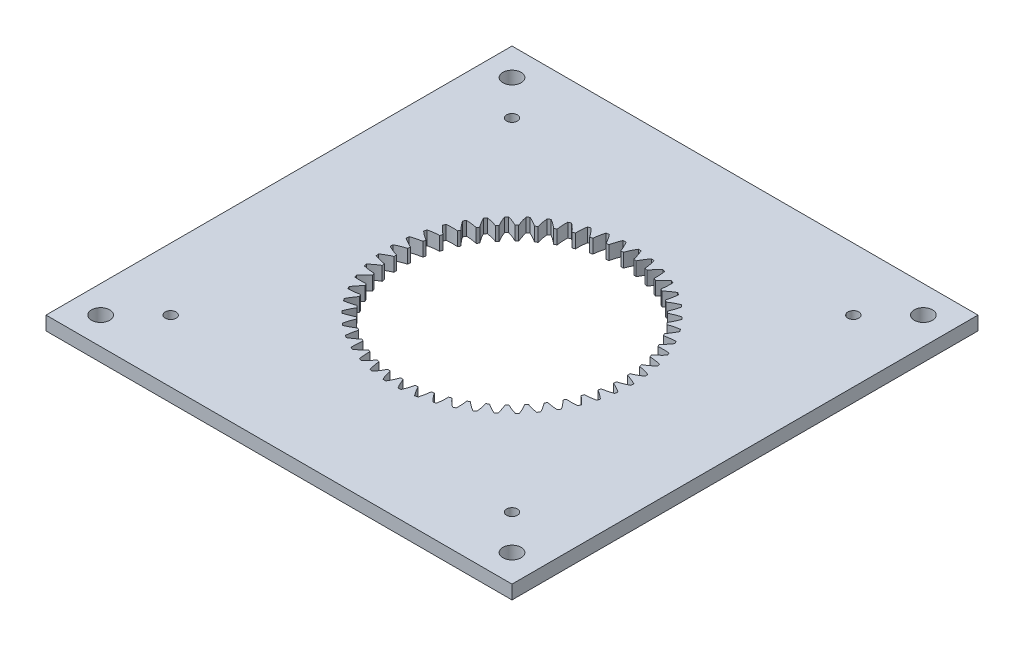
from build123d import *

# Parameters (mm, degrees)
SKETCH1_W           = 101.6
SKETCH1_H           = 101.6
BOSS_EXTRUDE1_DEPTH = 3
CUT_EXTRUDE2_DEPTH  = 161.150983893
SKETCH4_R           = 1.984375
SKETCH4_R_2         = 1.190625
CUT_EXTRUDE3_DEPTH  = 100


with BuildPart() as part:
    # Sketch1 → Boss-Extrude1 (new body)
    with BuildSketch(Plane(origin=(0, 0, 0), x_dir=(1, 0, 0), z_dir=(0, 1, 0))):
        Rectangle(SKETCH1_W, SKETCH1_H)
    extrude(amount=BOSS_EXTRUDE1_DEPTH)

    # Sketch3 → Cut-Extrude2 (cut, through all)
    with BuildSketch(Plane(origin=(-45.109803739, 10, -77.065738916), x_dir=(1, 0, 0), z_dir=(0, 1, 0))):
        with BuildLine():
            ThreePointArc((36.70104025, -52.197934478), (36.561215623, -53.418648212), (36.541912334, -54.6471922))
            ThreePointArc((36.541912334, -54.6471922), (36.274814475, -54.751103255), (36.008976503, -54.858196422))
            ThreePointArc((36.008976503, -54.858196422), (35.153908779, -53.975840408), (34.216344959, -53.181694937))
            ThreePointArc((34.216344959, -53.181694937), (33.932671556, -53.313123962), (33.65058352, -53.447922062))
            ThreePointArc((33.65058352, -53.447922062), (33.664857451, -54.676534776), (33.799683765, -55.897810672))
            ThreePointArc((33.799683765, -55.897810672), (33.547715561, -56.034378595), (33.297396134, -56.173945633))
            ThreePointArc((33.297396134, -56.173945633), (32.338482342, -55.405715663), (31.308778672, -54.735340171))
            ThreePointArc((31.308778672, -54.735340171), (31.043814544, -54.901286544), (30.780845538, -55.070376726))
            ThreePointArc((30.780845538, -55.070376726), (30.948992919, -56.287512464), (31.235822544, -57.482260017))
            ThreePointArc((31.235822544, -57.482260017), (31.002957684, -57.649331051), (30.772104489, -57.819170905))
            ThreePointArc((30.772104489, -57.819170905), (29.724467273, -57.177182423), (28.618862796, -56.641149133))
            ThreePointArc((28.618862796, -56.641149133), (28.376786584, -56.83899578), (28.137083787, -57.039711392))
            ThreePointArc((28.137083787, -57.039711392), (28.456452833, -58.226175196), (28.890762295, -59.375552523))
            ThreePointArc((28.890762295, -59.375552523), (28.680673197, -59.570491858), (28.472926926, -59.767926051))
            ThreePointArc((28.472926926, -59.767926051), (27.35308815, -59.262303601), (26.189018909, -58.869066077))
            ThreePointArc((26.189018909, -58.869066077), (25.973648301, -59.095692838), (25.760991968, -59.324868474))
            ThreePointArc((25.760991968, -59.324868474), (26.226546039, -60.461949102), (26.801486018, -61.547829836))
            ThreePointArc((26.801486018, -61.547829836), (26.617485912, -61.767563162), (26.436122849, -61.98947804))
            ThreePointArc((26.436122849, -61.98947804), (25.261743039, -61.628195588), (24.057567102, -61.383955422))
            ThreePointArc((24.057567102, -61.383955422), (23.87229862, -61.635788258), (23.690042469, -61.889809681))
            ThreePointArc((23.690042469, -61.889809681), (24.2944395, -62.959574692), (25.000942849, -63.964833845))
            ThreePointArc((25.000942849, -63.964833845), (24.845933527, -64.205895837), (24.693813875, -64.448791668))
            ThreePointArc((24.693813875, -64.448791668), (23.483413703, -64.237546856), (22.258121642, -64.14615586))
            ThreePointArc((22.258121642, -64.14615586), (22.105877081, -64.419223217), (21.956895401, -64.694084358))
            ThreePointArc((21.956895401, -64.694084358), (22.690603688, -65.679662918), (23.517528428, -66.588446953))
            ThreePointArc((23.517528428, -66.588446953), (23.39395448, -66.847035919), (23.273477256, -67.107082092))
            ThreePointArc((23.273477256, -67.107082092), (22.046145456, -67.049206375), (20.81906086, -67.112105841))
            ThreePointArc((20.81906086, -67.112105841), (20.702241208, -67.402101284), (20.588883529, -67.693467418))
            ThreePointArc((20.588883529, -67.693467418), (21.440332055, -68.579316364), (22.374637087, -69.377293214))
            ThreePointArc((22.374637087, -69.377293214), (22.284447348, -69.649331051), (22.197512551, -69.922426483))
            ThreePointArc((22.197512551, -69.922426483), (20.972604878, -70.018832596), (19.763079604, -70.235030562))
            ThreePointArc((19.763079604, -70.235030562), (19.683527176, -70.537380688), (19.607581216, -70.840656798))
            ThreePointArc((19.607581216, -70.840656798), (20.563342129, -71.612805764), (21.590292906, -72.287390857))
            ThreePointArc((21.590292906, -72.287390857), (21.534909722, -72.568587366), (21.482888365, -72.850425178))
            ThreePointArc((21.482888365, -72.850425178), (20.279722344, -73.09959274), (19.106831329, -73.465679633))
            ThreePointArc((19.106831329, -73.465679633), (19.065800715, -73.775616202), (19.028464187, -74.086019442))
            ThreePointArc((19.028464187, -74.086019442), (20.073464566, -74.732291177), (21.176865461, -75.272845904))
            ThreePointArc((21.176865461, -75.272845904), (21.157162257, -75.558766447), (21.140874749, -75.844901889))
            ThreePointArc((21.140874749, -75.844901889), (19.978425028, -76.242901378), (18.860665462, -76.75310379))
            ThreePointArc((18.860665462, -76.75310379), (18.858803739, -77.065738916), (18.860665462, -77.378374042))
            ThreePointArc((18.860665462, -77.378374042), (19.978425028, -77.888576454), (21.140874749, -78.286575944))
            ThreePointArc((21.140874749, -78.286575944), (21.157162257, -78.572711385), (21.176865461, -78.858631929))
            ThreePointArc((21.176865461, -78.858631929), (20.073464566, -79.399186656), (19.028464187, -80.04545839))
            ThreePointArc((19.028464187, -80.04545839), (19.065800715, -80.35586163), (19.106831329, -80.665798199))
            ThreePointArc((19.106831329, -80.665798199), (20.279722344, -81.031885092), (21.482888365, -81.281052655))
            ThreePointArc((21.482888365, -81.281052655), (21.534909722, -81.562890466), (21.590292906, -81.844086975))
            ThreePointArc((21.590292906, -81.844086975), (20.563342129, -82.518672069), (19.607581216, -83.290821034))
            ThreePointArc((19.607581216, -83.290821034), (19.683527176, -83.594097144), (19.763079604, -83.896447271))
            ThreePointArc((19.763079604, -83.896447271), (20.972604878, -84.112645236), (22.197512551, -84.20905135))
            ThreePointArc((22.197512551, -84.20905135), (22.284447348, -84.482146781), (22.374637087, -84.754184618))
            ThreePointArc((22.374637087, -84.754184618), (21.440332055, -85.552161468), (20.588883529, -86.438010414))
            ThreePointArc((20.588883529, -86.438010414), (20.702241208, -86.729376549), (20.81906086, -87.019371991))
            ThreePointArc((20.81906086, -87.019371991), (22.046145456, -87.082271457), (23.273477256, -87.02439574))
            ThreePointArc((23.273477256, -87.02439574), (23.39395448, -87.284441914), (23.517528428, -87.543030879))
            ThreePointArc((23.517528428, -87.543030879), (22.690603688, -88.451814915), (21.956895401, -89.437393474))
            ThreePointArc((21.956895401, -89.437393474), (22.105877081, -89.712254615), (22.258121642, -89.985321972))
            ThreePointArc((22.258121642, -89.985321972), (23.483413703, -89.893930977), (24.693813875, -89.682686164))
            ThreePointArc((24.693813875, -89.682686164), (24.845933527, -89.925581996), (25.000942849, -90.166643987))
            ThreePointArc((25.000942849, -90.166643987), (24.2944395, -91.171903141), (23.690042469, -92.241668151))
            ThreePointArc((23.690042469, -92.241668151), (23.87229862, -92.495689574), (24.057567102, -92.74752241))
            ThreePointArc((24.057567102, -92.74752241), (25.261743039, -92.503282244), (26.436122849, -92.141999793))
            ThreePointArc((26.436122849, -92.141999793), (26.617485912, -92.36391467), (26.801486018, -92.583647997))
            ThreePointArc((26.801486018, -92.583647997), (26.226546039, -93.66952873), (25.760991968, -94.806609358))
            ThreePointArc((25.760991968, -94.806609358), (25.973648301, -95.035784994), (26.189018909, -95.262411755))
            ThreePointArc((26.189018909, -95.262411755), (27.35308815, -94.869174232), (28.472926926, -94.363551781))
            ThreePointArc((28.472926926, -94.363551781), (28.680673197, -94.560985974), (28.890762295, -94.75592531))
            ThreePointArc((28.890762295, -94.75592531), (28.456452833, -95.905302636), (28.137083787, -97.091766441))
            ThreePointArc((28.137083787, -97.091766441), (28.376786584, -97.292482052), (28.618862796, -97.490328699))
            ThreePointArc((28.618862796, -97.490328699), (29.724467273, -96.954295409), (30.772104489, -96.312306927))
            ThreePointArc((30.772104489, -96.312306927), (31.002957684, -96.482146781), (31.235822544, -96.649217816))
            ThreePointArc((31.235822544, -96.649217816), (30.948992919, -97.843965368), (30.780845538, -99.061101106))
            ThreePointArc((30.780845538, -99.061101106), (31.043814544, -99.230191289), (31.308778672, -99.396137661))
            ThreePointArc((31.308778672, -99.396137661), (32.338482342, -98.725762169), (33.297396134, -97.957532199))
            ThreePointArc((33.297396134, -97.957532199), (33.547715561, -98.097099237), (33.799683765, -98.233667161))
            ThreePointArc((33.799683765, -98.233667161), (33.664857451, -99.454943056), (33.65058352, -100.683555771))
            ThreePointArc((33.65058352, -100.683555771), (33.932671556, -100.81835387), (34.216344959, -100.949782895))
            ThreePointArc((34.216344959, -100.949782895), (35.153908779, -100.155637424), (36.008976503, -99.27328141))
            ThreePointArc((36.008976503, -99.27328141), (36.274814475, -99.380374577), (36.541912334, -99.484285632))
            ThreePointArc((36.541912334, -99.484285632), (36.561215623, -100.71282962), (36.70104025, -101.933543355))
            ThreePointArc((36.70104025, -101.933543355), (36.99779862, -102.031923525), (37.295707597, -102.126762488))
            ThreePointArc((37.295707597, -102.126762488), (38.126345628, -101.221371186), (38.864082354, -100.23880441))
            ThreePointArc((38.864082354, -100.23880441), (39.141246447, -100.311734783), (39.419261668, -100.38135023))
            ThreePointArc((39.419261668, -100.38135023), (39.592390136, -101.597787438), (39.884108204, -102.791350807))
            ThreePointArc((39.884108204, -102.791350807), (40.19085685, -102.851761535), (40.4983032, -102.908514769))
            ThreePointArc((40.4983032, -102.908514769), (41.208915782, -101.906156197), (41.817686963, -100.838874324))
            ThreePointArc((41.817686963, -100.838874324), (42.101806134, -100.876491748), (42.386354251, -100.910713709))
            ThreePointArc((42.386354251, -100.910713709), (42.710577557, -102.095860196), (43.149588498, -103.243449993))
            ThreePointArc((43.149588498, -103.243449993), (43.461489811, -103.264938564), (43.773624921, -103.282711037))
            ThreePointArc((43.773624921, -103.282711037), (44.353005269, -102.199192989), (44.82321022, -101.064027692))
            ThreePointArc((44.82321022, -101.064027692), (45.109803739, -101.065738916), (45.396397258, -101.064027692))
            ThreePointArc((45.396397258, -101.064027692), (45.866602209, -102.199192989), (46.445982557, -103.282711037))
            ThreePointArc((46.445982557, -103.282711037), (46.758117667, -103.264938564), (47.07001898, -103.243449993))
            ThreePointArc((47.07001898, -103.243449993), (47.509029921, -102.095860196), (47.833253227, -100.910713709))
            ThreePointArc((47.833253227, -100.910713709), (48.117801345, -100.876491748), (48.401920515, -100.838874324))
            ThreePointArc((48.401920515, -100.838874324), (49.010691696, -101.906156197), (49.721304278, -102.908514769))
            ThreePointArc((49.721304278, -102.908514769), (50.028750628, -102.851761535), (50.335499274, -102.791350807))
            ThreePointArc((50.335499274, -102.791350807), (50.627217342, -101.597787438), (50.80034581, -100.38135023))
            ThreePointArc((50.80034581, -100.38135023), (51.078361031, -100.311734783), (51.355525124, -100.23880441))
            ThreePointArc((51.355525124, -100.23880441), (52.093261851, -101.221371186), (52.923899881, -102.126762488))
            ThreePointArc((52.923899881, -102.126762488), (53.221808858, -102.031923525), (53.518567228, -101.933543355))
            ThreePointArc((53.518567228, -101.933543355), (53.658391855, -100.71282962), (53.677695144, -99.484285632))
            ThreePointArc((53.677695144, -99.484285632), (53.944793004, -99.380374577), (54.210630975, -99.27328141))
            ThreePointArc((54.210630975, -99.27328141), (55.065698699, -100.155637424), (56.00326252, -100.949782895))
            ThreePointArc((56.00326252, -100.949782895), (56.286935922, -100.81835387), (56.569023958, -100.683555771))
            ThreePointArc((56.569023958, -100.683555771), (56.554750027, -99.454943056), (56.419923713, -98.233667161))
            ThreePointArc((56.419923713, -98.233667161), (56.671891918, -98.097099237), (56.922211344, -97.957532199))
            ThreePointArc((56.922211344, -97.957532199), (57.881125136, -98.725762169), (58.910828806, -99.396137661))
            ThreePointArc((58.910828806, -99.396137661), (59.175792934, -99.230191289), (59.43876194, -99.061101106))
            ThreePointArc((59.43876194, -99.061101106), (59.270614559, -97.843965368), (58.983784934, -96.649217816))
            ThreePointArc((58.983784934, -96.649217816), (59.216649794, -96.482146781), (59.447502989, -96.312306927))
            ThreePointArc((59.447502989, -96.312306927), (60.495140206, -96.954295409), (61.600744682, -97.490328699))
            ThreePointArc((61.600744682, -97.490328699), (61.842820894, -97.292482052), (62.082523692, -97.091766441))
            ThreePointArc((62.082523692, -97.091766441), (61.763154645, -95.905302636), (61.328845183, -94.75592531))
            ThreePointArc((61.328845183, -94.75592531), (61.538934281, -94.560985974), (61.746680552, -94.363551781))
            ThreePointArc((61.746680552, -94.363551781), (62.866519328, -94.869174232), (64.030588569, -95.262411755))
            ThreePointArc((64.030588569, -95.262411755), (64.245959178, -95.035784994), (64.45861551, -94.806609358))
            ThreePointArc((64.45861551, -94.806609358), (63.993061439, -93.66952873), (63.41812146, -92.583647997))
            ThreePointArc((63.41812146, -92.583647997), (63.602121566, -92.36391467), (63.783484629, -92.141999793))
            ThreePointArc((63.783484629, -92.141999793), (64.957864439, -92.503282244), (66.162040377, -92.74752241))
            ThreePointArc((66.162040377, -92.74752241), (66.347308858, -92.495689574), (66.529565009, -92.241668151))
            ThreePointArc((66.529565009, -92.241668151), (65.925167979, -91.171903141), (65.21866463, -90.166643987))
            ThreePointArc((65.21866463, -90.166643987), (65.373673951, -89.925581996), (65.525793603, -89.682686164))
            ThreePointArc((65.525793603, -89.682686164), (66.736193776, -89.893930977), (67.961485836, -89.985321972))
            ThreePointArc((67.961485836, -89.985321972), (68.113730397, -89.712254615), (68.262712077, -89.437393474))
            ThreePointArc((68.262712077, -89.437393474), (67.52900379, -88.451814915), (66.70207905, -87.543030879))
            ThreePointArc((66.70207905, -87.543030879), (66.825652998, -87.284441914), (66.946130222, -87.02439574))
            ThreePointArc((66.946130222, -87.02439574), (68.173462022, -87.082271457), (69.400546618, -87.019371991))
            ThreePointArc((69.400546618, -87.019371991), (69.51736627, -86.729376549), (69.63072395, -86.438010414))
            ThreePointArc((69.63072395, -86.438010414), (68.779275424, -85.552161468), (67.844970391, -84.754184618))
            ThreePointArc((67.844970391, -84.754184618), (67.93516013, -84.482146781), (68.022094927, -84.20905135))
            ThreePointArc((68.022094927, -84.20905135), (69.247002601, -84.112645236), (70.456527874, -83.896447271))
            ThreePointArc((70.456527874, -83.896447271), (70.536080302, -83.594097144), (70.612026262, -83.290821034))
            ThreePointArc((70.612026262, -83.290821034), (69.656265349, -82.518672069), (68.629314572, -81.844086975))
            ThreePointArc((68.629314572, -81.844086975), (68.684697757, -81.562890466), (68.736719113, -81.281052655))
            ThreePointArc((68.736719113, -81.281052655), (69.939885134, -81.031885092), (71.112776149, -80.665798199))
            ThreePointArc((71.112776149, -80.665798199), (71.153806763, -80.35586163), (71.191143292, -80.04545839))
            ThreePointArc((71.191143292, -80.04545839), (70.146142912, -79.399186656), (69.042742018, -78.858631929))
            ThreePointArc((69.042742018, -78.858631929), (69.062445221, -78.572711385), (69.07873273, -78.286575944))
            ThreePointArc((69.07873273, -78.286575944), (70.241182451, -77.888576454), (71.358942016, -77.378374042))
            ThreePointArc((71.358942016, -77.378374042), (71.360803739, -77.065738916), (71.358942016, -76.75310379))
            ThreePointArc((71.358942016, -76.75310379), (70.241182451, -76.242901378), (69.07873273, -75.844901889))
            ThreePointArc((69.07873273, -75.844901889), (69.062445221, -75.558766447), (69.042742018, -75.272845904))
            ThreePointArc((69.042742018, -75.272845904), (70.146142912, -74.732291177), (71.191143292, -74.086019442))
            ThreePointArc((71.191143292, -74.086019442), (71.153806763, -73.775616202), (71.112776149, -73.465679633))
            ThreePointArc((71.112776149, -73.465679633), (69.939885134, -73.09959274), (68.736719113, -72.850425178))
            ThreePointArc((68.736719113, -72.850425178), (68.684697757, -72.568587366), (68.629314572, -72.287390857))
            ThreePointArc((68.629314572, -72.287390857), (69.656265349, -71.612805764), (70.612026262, -70.840656798))
            ThreePointArc((70.612026262, -70.840656798), (70.536080302, -70.537380688), (70.456527874, -70.235030562))
            ThreePointArc((70.456527874, -70.235030562), (69.247002601, -70.018832596), (68.022094927, -69.922426483))
            ThreePointArc((68.022094927, -69.922426483), (67.93516013, -69.649331051), (67.844970391, -69.377293214))
            ThreePointArc((67.844970391, -69.377293214), (68.779275424, -68.579316364), (69.63072395, -67.693467418))
            ThreePointArc((69.63072395, -67.693467418), (69.51736627, -67.402101284), (69.400546618, -67.112105841))
            ThreePointArc((69.400546618, -67.112105841), (68.173462022, -67.049206375), (66.946130222, -67.107082092))
            ThreePointArc((66.946130222, -67.107082092), (66.825652998, -66.847035919), (66.70207905, -66.588446953))
            ThreePointArc((66.70207905, -66.588446953), (67.52900379, -65.679662918), (68.262712077, -64.694084358))
            ThreePointArc((68.262712077, -64.694084358), (68.113730397, -64.419223217), (67.961485836, -64.14615586))
            ThreePointArc((67.961485836, -64.14615586), (66.736193776, -64.237546856), (65.525793603, -64.448791668))
            ThreePointArc((65.525793603, -64.448791668), (65.373673951, -64.205895837), (65.21866463, -63.964833845))
            ThreePointArc((65.21866463, -63.964833845), (65.925167979, -62.959574692), (66.529565009, -61.889809681))
            ThreePointArc((66.529565009, -61.889809681), (66.347308858, -61.635788258), (66.162040377, -61.383955422))
            ThreePointArc((66.162040377, -61.383955422), (64.957864439, -61.628195588), (63.783484629, -61.98947804))
            ThreePointArc((63.783484629, -61.98947804), (63.602121566, -61.767563162), (63.41812146, -61.547829836))
            ThreePointArc((63.41812146, -61.547829836), (63.993061439, -60.461949102), (64.45861551, -59.324868474))
            ThreePointArc((64.45861551, -59.324868474), (64.245959178, -59.095692838), (64.030588569, -58.869066077))
            ThreePointArc((64.030588569, -58.869066077), (62.866519328, -59.262303601), (61.746680552, -59.767926051))
            ThreePointArc((61.746680552, -59.767926051), (61.538934281, -59.570491858), (61.328845183, -59.375552523))
            ThreePointArc((61.328845183, -59.375552523), (61.763154645, -58.226175196), (62.082523692, -57.039711392))
            ThreePointArc((62.082523692, -57.039711392), (61.842820894, -56.83899578), (61.600744682, -56.641149133))
            ThreePointArc((61.600744682, -56.641149133), (60.495140206, -57.177182423), (59.447502989, -57.819170905))
            ThreePointArc((59.447502989, -57.819170905), (59.216649794, -57.649331051), (58.983784934, -57.482260017))
            ThreePointArc((58.983784934, -57.482260017), (59.270614559, -56.287512464), (59.43876194, -55.070376726))
            ThreePointArc((59.43876194, -55.070376726), (59.175792934, -54.901286544), (58.910828806, -54.735340171))
            ThreePointArc((58.910828806, -54.735340171), (57.881125136, -55.405715663), (56.922211344, -56.173945633))
            ThreePointArc((56.922211344, -56.173945633), (56.671891918, -56.034378595), (56.419923713, -55.897810672))
            ThreePointArc((56.419923713, -55.897810672), (56.554750027, -54.676534776), (56.569023958, -53.447922062))
            ThreePointArc((56.569023958, -53.447922062), (56.286935922, -53.313123962), (56.00326252, -53.181694937))
            ThreePointArc((56.00326252, -53.181694937), (55.065698699, -53.975840408), (54.210630975, -54.858196422))
            ThreePointArc((54.210630975, -54.858196422), (53.944793004, -54.751103255), (53.677695144, -54.6471922))
            ThreePointArc((53.677695144, -54.6471922), (53.658391855, -53.418648212), (53.518567228, -52.197934478))
            ThreePointArc((53.518567228, -52.197934478), (53.221808858, -52.099554307), (52.923899881, -52.004715344))
            ThreePointArc((52.923899881, -52.004715344), (52.093261851, -52.910106646), (51.355525124, -53.892673422))
            ThreePointArc((51.355525124, -53.892673422), (51.078361031, -53.819743049), (50.80034581, -53.750127602))
            ThreePointArc((50.80034581, -53.750127602), (50.627217342, -52.533690394), (50.335499274, -51.340127025))
            ThreePointArc((50.335499274, -51.340127025), (50.028750628, -51.279716297), (49.721304278, -51.222963063))
            ThreePointArc((49.721304278, -51.222963063), (49.010691696, -52.225321635), (48.401920515, -53.292603508))
            ThreePointArc((48.401920515, -53.292603508), (48.117801345, -53.254986085), (47.833253227, -53.220764123))
            ThreePointArc((47.833253227, -53.220764123), (47.509029921, -52.035617636), (47.07001898, -50.88802784))
            ThreePointArc((47.07001898, -50.88802784), (46.758117667, -50.866539268), (46.445982557, -50.848766796))
            ThreePointArc((46.445982557, -50.848766796), (45.866602209, -51.932284843), (45.396397258, -53.067450141))
            ThreePointArc((45.396397258, -53.067450141), (45.109803739, -53.065738916), (44.82321022, -53.067450141))
            ThreePointArc((44.82321022, -53.067450141), (44.353005269, -51.932284843), (43.773624921, -50.848766796))
            ThreePointArc((43.773624921, -50.848766796), (43.461489811, -50.866539268), (43.149588498, -50.88802784))
            ThreePointArc((43.149588498, -50.88802784), (42.710577557, -52.035617636), (42.386354251, -53.220764123))
            ThreePointArc((42.386354251, -53.220764123), (42.101806134, -53.254986085), (41.817686963, -53.292603508))
            ThreePointArc((41.817686963, -53.292603508), (41.208915782, -52.225321635), (40.4983032, -51.222963063))
            ThreePointArc((40.4983032, -51.222963063), (40.19085685, -51.279716297), (39.884108204, -51.340127025))
            ThreePointArc((39.884108204, -51.340127025), (39.592390136, -52.533690394), (39.419261668, -53.750127602))
            ThreePointArc((39.419261668, -53.750127602), (39.141246447, -53.819743049), (38.864082354, -53.892673422))
            ThreePointArc((38.864082354, -53.892673422), (38.126345628, -52.910106646), (37.295707597, -52.004715344))
            ThreePointArc((37.295707597, -52.004715344), (36.99779862, -52.099554307), (36.70104025, -52.197934478))
        make_face()
    extrude(amount=-CUT_EXTRUDE2_DEPTH, mode=Mode.SUBTRACT)

    # Sketch4 → Cut-Extrude3 (cut)
    with BuildSketch(Plane(origin=(23.804851427, -0.7366, -67.655446535), x_dir=(0.7071067811865436, 0, -0.7071067811865516), z_dir=(0, -1, 0))):
        with Locations(Location((-64.672196899, 94.425621887, 0), (0, 0, 135))):
            Circle(SKETCH4_R)
        with Locations(Location((-1.253628172, 31.00705316, 0), (0, 0, 135))):
            Circle(SKETCH4_R)
        with Locations(Location((-64.672196899, 83.631354029, 0), (0, 0, 135))):
            Circle(SKETCH4_R_2)
        with Locations(Location((-12.047896029, 31.00705316, 0), (0, 0, 135))):
            Circle(SKETCH4_R_2)
        with Locations(Location((-64.672196899, -32.411515567, 0), (0, 0, 135))):
            Circle(SKETCH4_R)
        with Locations(Location((-64.672196899, -21.61724771, 0), (0, 0, 135))):
            Circle(SKETCH4_R_2)
        with Locations(Location((-128.090765626, 31.00705316, 0), (0, 0, 135))):
            Circle(SKETCH4_R)
        with Locations(Location((-117.296497768, 31.00705316, 0), (0, 0, 135))):
            Circle(SKETCH4_R_2)
    extrude(amount=-CUT_EXTRUDE3_DEPTH, mode=Mode.SUBTRACT)


solid = part.part
